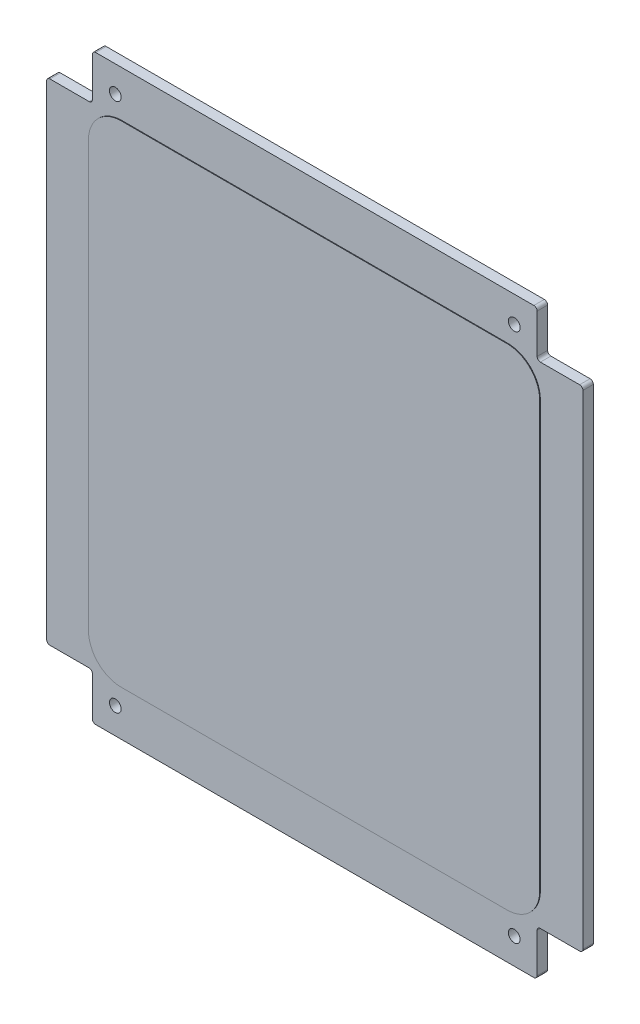
from build123d import *

# Parameters (mm, degrees)
BOSS_EXTRUDE1_DEPTH              = 1.6
BOSS_EXTRUDE2_DEPTH              = 0.1
M1_6_HOLE1_FIXINGSTRUCTURE_D     = 1.8
M1_6_HOLE1_FIXINGSTRUCTURE_DEPTH = 200
M1_6_HOLE1_FIXINGSTRUCTURE_TIP   = 0.540774557


with BuildPart() as part:
    # Sketch1 → Boss-Extrude1 (new body)
    with BuildSketch(Plane.XY):
        with BuildLine():
            Line((-34, 44), (-34, 38))
            ThreePointArc((-34, 38), (-34.146446609, 37.646446609), (-34.5, 37.5))
            Line((-34.5, 37.5), (-40.5, 37.5))
            ThreePointArc((-40.5, 37.5), (-40.853553391, 37.353553391), (-41, 37))
            Line((-41, 37), (-41, -37))
            ThreePointArc((-41, -37), (-40.853553391, -37.353553391), (-40.5, -37.5))
            Line((-40.5, -37.5), (-34.5, -37.5))
            ThreePointArc((-34.5, -37.5), (-34.146446609, -37.646446609), (-34, -38))
            Line((-34, -38), (-34, -44))
            ThreePointArc((-34, -44), (-33.853553391, -44.353553391), (-33.5, -44.5))
            Line((-33.5, -44.5), (33.5, -44.5))
            ThreePointArc((33.5, -44.5), (33.853553391, -44.353553391), (34, -44))
            Line((34, -44), (34, -38))
            ThreePointArc((34, -38), (34.146446609, -37.646446609), (34.5, -37.5))
            Line((34.5, -37.5), (40.5, -37.5))
            ThreePointArc((40.5, -37.5), (40.853553391, -37.353553391), (41, -37))
            Line((41, -37), (41, 37))
            ThreePointArc((41, 37), (40.853553391, 37.353553391), (40.5, 37.5))
            Line((40.5, 37.5), (34.5, 37.5))
            ThreePointArc((34.5, 37.5), (34.146446609, 37.646446609), (34, 38))
            Line((34, 38), (34, 44))
            ThreePointArc((34, 44), (33.853553391, 44.353553391), (33.5, 44.5))
            Line((33.5, 44.5), (-33.5, 44.5))
            ThreePointArc((-33.5, 44.5), (-33.853553391, 44.353553391), (-34, 44))
        make_face()
    extrude(amount=BOSS_EXTRUDE1_DEPTH)

    # Esboço1 → Boss-Extrude2 (add)
    with BuildSketch(Plane.XY.offset(1.6)):
        with BuildLine():
            Line((-29.5, -37.5), (29.5, -37.5))
            ThreePointArc((29.5, -37.5), (33.035533906, -36.035533906), (34.5, -32.5))
            Line((34.5, -32.5), (34.5, 32.5))
            ThreePointArc((34.5, 32.5), (33.035533906, 36.035533906), (29.5, 37.5))
            Line((29.5, 37.5), (-29.5, 37.5))
            ThreePointArc((-29.5, 37.5), (-33.035533906, 36.035533906), (-34.5, 32.5))
            Line((-34.5, 32.5), (-34.5, -32.5))
            ThreePointArc((-34.5, -32.5), (-33.035533906, -36.035533906), (-29.5, -37.5))
        make_face()
    extrude(amount=BOSS_EXTRUDE2_DEPTH)

    # M1.6 Hole1-FixingStructure
    with Locations(Plane(origin=(0, 0, 0), x_dir=(-1, 0, 0), z_dir=(0, 0, -1))):
        with Locations((-30.5, 40.5), (30.5, 40.5), (-30.5, -40.5), (30.5, -40.5)):
            Hole(M1_6_HOLE1_FIXINGSTRUCTURE_D / 2, depth=M1_6_HOLE1_FIXINGSTRUCTURE_DEPTH)
            with Locations((0, 0, -(M1_6_HOLE1_FIXINGSTRUCTURE_DEPTH + M1_6_HOLE1_FIXINGSTRUCTURE_TIP / 2))):  # 118° drill point
                Cone(0, M1_6_HOLE1_FIXINGSTRUCTURE_D / 2, M1_6_HOLE1_FIXINGSTRUCTURE_TIP, mode=Mode.SUBTRACT)


solid = part.part
